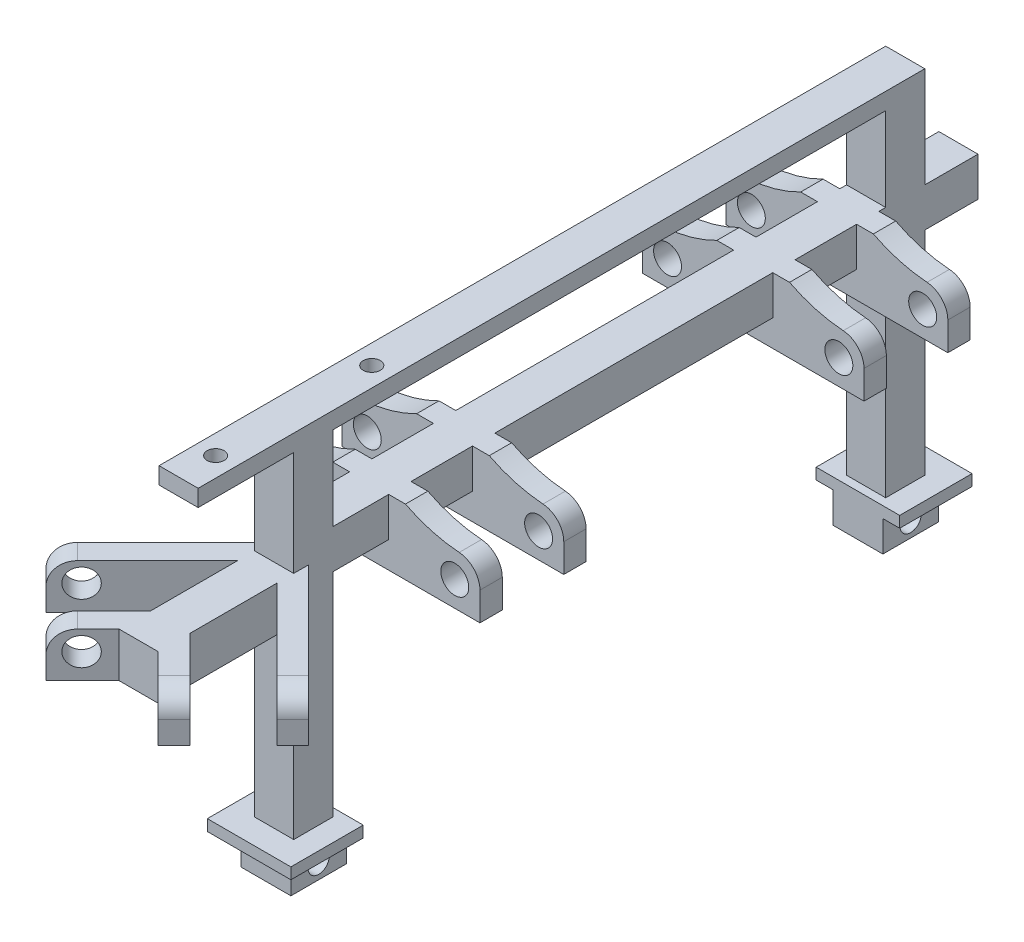
from build123d import *

# Parameters (mm, degrees)
SKETCH1_W             = 8.94
SKETCH1_H             = 9.94
BOSS_EXTRUDE1_DEPTH   = 5.5
BOSS_EXTRUDE1_2_DEPTH = 5.5
SKETCH2_R             = 1.9
CUT_EXTRUDE1_DEPTH    = 112.40557302
SKETCH3_W             = 14.95
SKETCH3_H             = 12.95
BOSS_EXTRUDE2_DEPTH   = 2
SKETCH4_W             = 7
SKETCH4_H             = 7
BOSS_EXTRUDE3_DEPTH   = 45
SKETCH5_W             = 7
SKETCH5_H             = 7
BOSS_EXTRUDE4_DEPTH   = 98.94
BOSS_EXTRUDE5_START   = -11
SKETCH6_R             = 2.5
BOSS_EXTRUDE5_DEPTH   = 4
BOSS_EXTRUDE6_START   = 4
SKETCH6_2_R           = 2.5
BOSS_EXTRUDE6_DEPTH   = 4
SKETCH7_W             = 7
SKETCH7_H             = 7
BOSS_EXTRUDE7_DEPTH   = 9.52
BOSS_EXTRUDE8_START   = -11
SKETCH9_R             = 2.5
BOSS_EXTRUDE8_DEPTH   = 4
BOSS_EXTRUDE9_START   = 4
SKETCH9_2_W           = 7
SKETCH9_2_H           = 7
SKETCH9_2_R           = 2.5
BOSS_EXTRUDE9_DEPTH   = 4
BOSS_EXTRUDE10_DEPTH  = 8
SKETCH11_R            = 2.5
CUT_EXTRUDE2_DEPTH    = 128.459123123
SKETCH12_R            = 2.5
CUT_EXTRUDE3_DEPTH    = 128.459123123
FILLET1_R             = 4
SKETCH13_W            = 7
SKETCH13_H            = 7
BOSS_EXTRUDE11_DEPTH  = 15
SKETCH14_W            = 7
SKETCH14_H            = 41.2
SKETCH14_R            = 1.525
BOSS_EXTRUDE12_DEPTH  = 3
SKETCH15_W            = 7
SKETCH15_H            = 7
BOSS_EXTRUDE13_DEPTH  = 15
SKETCH16_W            = 7
SKETCH16_H            = 88.84
BOSS_EXTRUDE14_DEPTH  = 3


with BuildPart() as part:
    # Sketch1 → Boss-Extrude1 (new body)
    with BuildSketch(Plane(origin=(0, 0, 0), x_dir=(1, 0, 0), z_dir=(0, 1, 0))):
        Rectangle(SKETCH1_W, SKETCH1_H)
    extrude(amount=BOSS_EXTRUDE1_DEPTH)


with BuildPart() as body_2:
    # Sketch1 → Boss-Extrude1 2 (new body)
    with BuildSketch(Plane(origin=(0, 0, 0), x_dir=(1, 0, 0), z_dir=(0, 1, 0))):
        with Locations((0, -105.94)):
            Rectangle(SKETCH1_W, SKETCH1_H)
    extrude(amount=BOSS_EXTRUDE1_2_DEPTH)


with BuildPart() as cut_extrude1_tool:
    # Sketch2 → Cut-Extrude1 (new, through all)
    with BuildSketch(Plane(origin=(4.47, 0, 0), x_dir=(0, 0, -1), z_dir=(1, 0, 0))):
        with Locations((0, 2.75)):
            Circle(SKETCH2_R)
        with Locations(Location((-105.94, 2.75, 0), (0, 0, 180))):
            Circle(SKETCH2_R)
    extrude(amount=-CUT_EXTRUDE1_DEPTH)


with BuildPart() as part_1:
    add(part.part)

    # Cut-Extrude1: cut by cut_extrude1_tool
    add(cut_extrude1_tool.part, mode=Mode.SUBTRACT)



with BuildPart() as body_2_1:
    add(body_2.part)

    # Cut-Extrude1: cut by cut_extrude1_tool
    add(cut_extrude1_tool.part, mode=Mode.SUBTRACT)


with BuildPart() as part_2:
    add(part_1.part)

    add(body_2_1.part)  # Boss-Extrude2 merges body 2
    # Sketch3 → Boss-Extrude2 (add)
    with BuildSketch(Plane(origin=(0, 5.5, 0), x_dir=(1, 0, 0), z_dir=(0, 1, 0))):
        with Locations((0, 1.505)):
            Rectangle(SKETCH3_W, SKETCH3_H)
        with Locations((0, -107.445)):
            Rectangle(SKETCH3_W, SKETCH3_H)
    extrude(amount=BOSS_EXTRUDE2_DEPTH)

    # Sketch4 → Boss-Extrude3 (add)
    with BuildSketch(Plane(origin=(0, 7.5, 0), x_dir=(1, 0, 0), z_dir=(0, 1, 0))):
        Rectangle(SKETCH4_W, SKETCH4_H)
        with Locations((0, -105.94)):
            Rectangle(SKETCH4_W, SKETCH4_H)
    extrude(amount=BOSS_EXTRUDE3_DEPTH)

    # Sketch5 → Boss-Extrude4 (add)
    with BuildSketch(Plane.XY.offset(3.5)):
        with Locations((0, 49)):
            Rectangle(SKETCH5_W, SKETCH5_H)
    extrude(amount=BOSS_EXTRUDE4_DEPTH)

    # Sketch6 → Boss-Extrude5 (add)
    with BuildSketch(Plane.XY.offset(88.44).offset(BOSS_EXTRUDE5_START)):
        with BuildLine():
            Line((-19.83, 40.75), (-19.83, 49.75))
            Line((-19.83, 49.75), (-17.899013115, 49.75))
            ThreePointArc((-17.899013115, 49.75), (-12.035993415, 50.447222381), (-6.5, 52.5))
            Line((-6.5, 52.5), (-3.5, 52.5))
            Line((-3.5, 52.5), (3.5, 52.5))
            Line((3.5, 52.5), (6.5, 52.5))
            ThreePointArc((6.5, 52.5), (12.035993415, 50.447222381), (17.899013115, 49.75))
            Line((17.899013115, 49.75), (19.83, 49.75))
            Line((19.83, 49.75), (19.83, 40.75))
            Line((19.83, 40.75), (3.5, 40.75))
            Line((3.5, 40.75), (-3.5, 40.75))
            Line((-3.5, 40.75), (-19.83, 40.75))
        make_face()
        with Locations((-15.33, 45.25)):
            Circle(SKETCH6_R, mode=Mode.SUBTRACT)
        with Locations(Location((15.33, 45.25, 0), (0, 0, 180))):
            Circle(SKETCH6_R, mode=Mode.SUBTRACT)
    extrude(amount=-BOSS_EXTRUDE5_DEPTH)

    # Sketch6<2> → Boss-Extrude6 (add)
    with BuildSketch(Plane.XY.offset(88.44).offset(BOSS_EXTRUDE6_START)):
        with BuildLine():
            Line((-19.83, 40.75), (-19.83, 49.75))
            Line((-19.83, 49.75), (-17.899013115, 49.75))
            ThreePointArc((-17.899013115, 49.75), (-12.035993415, 50.447222381), (-6.5, 52.5))
            Line((-6.5, 52.5), (-3.5, 52.5))
            Line((-3.5, 52.5), (3.5, 52.5))
            Line((3.5, 52.5), (6.5, 52.5))
            ThreePointArc((6.5, 52.5), (12.035993415, 50.447222381), (17.899013115, 49.75))
            Line((17.899013115, 49.75), (19.83, 49.75))
            Line((19.83, 49.75), (19.83, 40.75))
            Line((19.83, 40.75), (3.5, 40.75))
            Line((3.5, 40.75), (-3.5, 40.75))
            Line((-3.5, 40.75), (-19.83, 40.75))
        make_face()
        with Locations((-15.33, 45.25)):
            Circle(SKETCH6_2_R, mode=Mode.SUBTRACT)
        with Locations(Location((15.33, 45.25, 0), (0, 0, 180))):
            Circle(SKETCH6_2_R, mode=Mode.SUBTRACT)
    extrude(amount=-BOSS_EXTRUDE6_DEPTH)

    # Sketch7 → Boss-Extrude7 (add)
    with BuildSketch(Plane(origin=(0, 0, -3.5), x_dir=(-1, 0, 0), z_dir=(0, 0, -1))):
        with Locations((0, 49)):
            Rectangle(SKETCH7_W, SKETCH7_H)
    extrude(amount=BOSS_EXTRUDE7_DEPTH)

    # Sketch9 → Boss-Extrude8 (add)
    with BuildSketch(Plane.XY.offset(19.71).offset(BOSS_EXTRUDE8_START)):
        with BuildLine():
            Line((-3.5, 52.5), (3.5, 52.5))
            Line((3.5, 52.5), (6.5, 52.5))
            ThreePointArc((6.5, 52.5), (12.035993415, 50.447222381), (17.899013115, 49.75))
            Line((17.899013115, 49.75), (19.83, 49.75))
            Line((19.83, 49.75), (19.83, 40.75))
            Line((19.83, 40.75), (-19.83, 40.75))
            Line((-19.83, 40.75), (-19.83, 49.75))
            Line((-19.83, 49.75), (-17.899013115, 49.75))
            ThreePointArc((-17.899013115, 49.75), (-12.035993415, 50.447222381), (-6.5, 52.5))
            Line((-6.5, 52.5), (-3.5, 52.5))
        make_face()
        with Locations((-15.33, 45.25)):
            Circle(SKETCH9_R, mode=Mode.SUBTRACT)
        with Locations(Location((15.33, 45.25, 0), (0, 0, 180))):
            Circle(SKETCH9_R, mode=Mode.SUBTRACT)
    extrude(amount=-BOSS_EXTRUDE8_DEPTH)

    # Sketch9<2> → Boss-Extrude9 (add)
    # profile 1 of 2: a face of its own
    with BuildSketch(Plane.XY.offset(19.71).offset(BOSS_EXTRUDE9_START)):
        with Locations((0, 49)):
            Rectangle(SKETCH9_2_W, SKETCH9_2_H)
    # profile 2 of 2: a face of its own
    with BuildSketch(Plane.XY.offset(19.71).offset(BOSS_EXTRUDE9_START)):
        with BuildLine():
            Line((-3.5, 45.5), (-3.5, 52.5))
            Line((-3.5, 52.5), (-6.5, 52.5))
            ThreePointArc((-6.5, 52.5), (-12.035993415, 50.447222381), (-17.899013115, 49.75))
            Line((-17.899013115, 49.75), (-19.83, 49.75))
            Line((-19.83, 49.75), (-19.83, 40.75))
            Line((-19.83, 40.75), (19.83, 40.75))
            Line((19.83, 40.75), (19.83, 49.75))
            Line((19.83, 49.75), (17.899013115, 49.75))
            ThreePointArc((17.899013115, 49.75), (12.035993415, 50.447222381), (6.5, 52.5))
            Line((6.5, 52.5), (3.5, 52.5))
            Line((3.5, 52.5), (3.5, 45.5))
            Line((3.5, 45.5), (-3.5, 45.5))
        make_face()
        with Locations((-15.33, 45.25)):
            Circle(SKETCH9_2_R, mode=Mode.SUBTRACT)
        with Locations(Location((15.33, 45.25, 0), (0, 0, 180))):
            Circle(SKETCH9_2_R, mode=Mode.SUBTRACT)
    extrude(amount=-BOSS_EXTRUDE9_DEPTH)

    # Sketch10 → Boss-Extrude10 (add)
    with BuildSketch(Plane.XZ.offset(-40.75)):
        Polygon((20.647514421, 129.62040764), (3.5, 112.472893219), (3.5, 128.029242405), (12.869339828, 137.398582233), (10.040912703, 140.227009358), (3.5, 133.686096654), (-3.5, 133.686096654), (-10.040912703, 140.227009358), (-12.869339828, 137.398582233), (-3.5, 128.029242405), (-3.5, 112.472893219), (-20.647514421, 129.62040764), (-23.475941546, 126.791980515), (-3.5, 106.816038969), (-3.5, 109.44), (3.5, 109.44), (3.5, 106.816038969), (23.475941546, 126.791980515), align=None)
    extrude(amount=-BOSS_EXTRUDE10_DEPTH)

    # Sketch11 → Cut-Extrude2 (cut, through all)
    with BuildSketch(Plane(origin=(51.658019485, 0, 51.658019485), x_dir=(-0.7071067811865486, 0, 0.7071067811865465), z_dir=(-0.7071067811865465, 0, -0.7071067811865486))):
        with Locations((101.755466684, 45.25)):
            Circle(SKETCH11_R)
    extrude(amount=-CUT_EXTRUDE2_DEPTH, mode=Mode.SUBTRACT)

    # Sketch12 → Cut-Extrude3 (cut, through all)
    with BuildSketch(Plane(origin=(-51.658019485, 0, 51.658019485), x_dir=(-0.7071067811865486, 0, -0.7071067811865465), z_dir=(0.7071067811865465, 0, -0.7071067811865486))):
        with Locations((-101.755466684, 45.25)):
            Circle(SKETCH12_R)
    extrude(amount=-CUT_EXTRUDE3_DEPTH, mode=Mode.SUBTRACT)

    # Fillet1
    fillet1_edges = [part_2.edges().sort_by_distance(p)[0] for p in [
        (22.061727984, 48.75, 128.206194078),
        (11.455126266, 48.75, 138.812795796),
        (-11.455126266, 48.75, 138.812795796),
        (-22.061727984, 48.75, 128.206194078),
        (-19.83, 49.75, 21.71),
        (-19.83, 49.75, 6.71),
        (19.83, 49.75, 6.71),
        (19.83, 49.75, 21.71),
        (19.83, 49.75, 90.44),
        (19.83, 49.75, 75.44),
        (-19.83, 49.75, 75.44),
        (-19.83, 49.75, 90.44),
    ]]
    fillet(fillet1_edges, radius=FILLET1_R)

    # Sketch13 → Boss-Extrude11 (add)
    with BuildSketch(Plane(origin=(0, 52.5, 0), x_dir=(1, 0, 0), z_dir=(0, 1, 0))):
        with Locations((0, -105.94)):
            Rectangle(SKETCH13_W, SKETCH13_H)
    extrude(amount=BOSS_EXTRUDE11_DEPTH)

    # Sketch14 → Boss-Extrude12 (add)
    with BuildSketch(Plane(origin=(0, 67.5, 0), x_dir=(1, 0, 0), z_dir=(0, 1, 0))):
        with Locations((0, -105.94)):
            Rectangle(SKETCH14_W, SKETCH14_H)
        with Locations(Location((0, -91.97, 0), (0, 0, 270))):
            Circle(SKETCH14_R, mode=Mode.SUBTRACT)
        with Locations(Location((0, -119.91, 0), (0, 0, 90))):
            Circle(SKETCH14_R, mode=Mode.SUBTRACT)
    extrude(amount=BOSS_EXTRUDE12_DEPTH)

    # Sketch15 → Boss-Extrude13 (add)
    with BuildSketch(Plane(origin=(0, 52.5, 0), x_dir=(1, 0, 0), z_dir=(0, 1, 0))):
        Rectangle(SKETCH15_W, SKETCH15_H)
    extrude(amount=BOSS_EXTRUDE13_DEPTH)

    # Sketch16 → Boss-Extrude14 (add)
    with BuildSketch(Plane(origin=(0, 67.5, 0), x_dir=(1, 0, 0), z_dir=(0, 1, 0))):
        with Locations((0, -40.92)):
            Rectangle(SKETCH16_W, SKETCH16_H)
    extrude(amount=BOSS_EXTRUDE14_DEPTH)


solid = part_2.part
